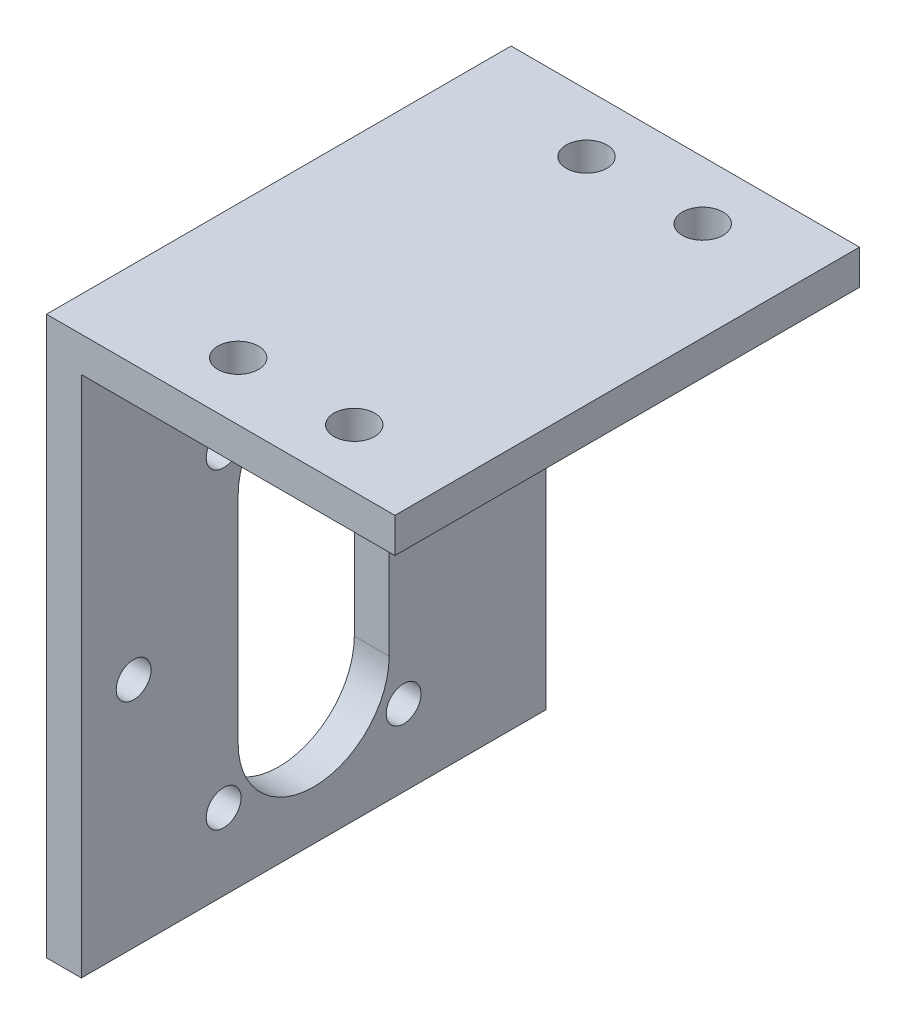
from build123d import *

# Parameters (mm, degrees)
SKETCH_1_W          = 30
SKETCH_1_H          = 40
EXTRUDE_1_DEPTH     = 48
SHELL_1_T           = -3
SKETCH_2_R          = 1.75
CUT_EXTRUDE_1_DEPTH = 68.268120235
SKETCH_3_R          = 1.5
CUT_EXTRUDE_3_DEPTH = 70.310893805


with BuildPart() as part:
    # 草图1 → 凸台-拉伸1 (new body)
    with BuildSketch(Plane(origin=(0, 0, 0), x_dir=(1, 0, 0), z_dir=(0, 1, 0))):
        with Locations((15, -20)):
            Rectangle(SKETCH_1_W, SKETCH_1_H)
    extrude(amount=EXTRUDE_1_DEPTH)

    # 抽壳1
    shell_1_openings = [part.faces().sort_by_distance(p)[0] for p in [
        (15, 0, 20),
        (15, 24, 0),
        (30, 24, 20),
        (15, 24, 40),
    ]]
    offset(amount=SHELL_1_T, openings=shell_1_openings, kind=Kind.INTERSECTION)

    # 草图2 → 切除-拉伸1 (cut, through all)
    with BuildSketch(Plane.XZ.offset(-45)):
        with Locations(Location((11.5, 35, 0), (0, 0, 270))):
            Circle(SKETCH_2_R)
        with Locations(Location((21.5, 35, 0), (0, 0, 270))):
            Circle(SKETCH_2_R)
        with Locations(Location((21.5, 5, 0), (0, 0, 90))):
            Circle(SKETCH_2_R)
        with Locations(Location((11.5, 5, 0), (0, 0, 90))):
            Circle(SKETCH_2_R)
    extrude(amount=-CUT_EXTRUDE_1_DEPTH, mode=Mode.SUBTRACT)

    # 草图3 → 切除-拉伸3 (cut, through all)
    with BuildSketch(Plane.ZY):
        with Locations((27.75, 6.576606241)):
            Circle(SKETCH_3_R)
        with Locations((12.25, 6.576606241)):
            Circle(SKETCH_3_R)
        with Locations((4.5, 20)):
            Circle(SKETCH_3_R)
        with Locations((12.25, 33.423393759)):
            Circle(SKETCH_3_R)
        with Locations((27.75, 33.423393759)):
            Circle(SKETCH_3_R)
        with Locations((35.5, 20)):
            Circle(SKETCH_3_R)
        with BuildLine():
            Line((26.5, 20), (26.5, 29.252110748))
            ThreePointArc((26.5, 29.252110748), (20, 35.752110748), (13.5, 29.252110748))
            Line((13.5, 29.252110748), (13.5, 20))
            Line((13.5, 20), (13.5, 10.747889252))
            ThreePointArc((13.5, 10.747889252), (20, 4.247889252), (26.5, 10.747889252))
            Line((26.5, 10.747889252), (26.5, 20))
        make_face()
    extrude(amount=-CUT_EXTRUDE_3_DEPTH, mode=Mode.SUBTRACT)


solid = part.part
